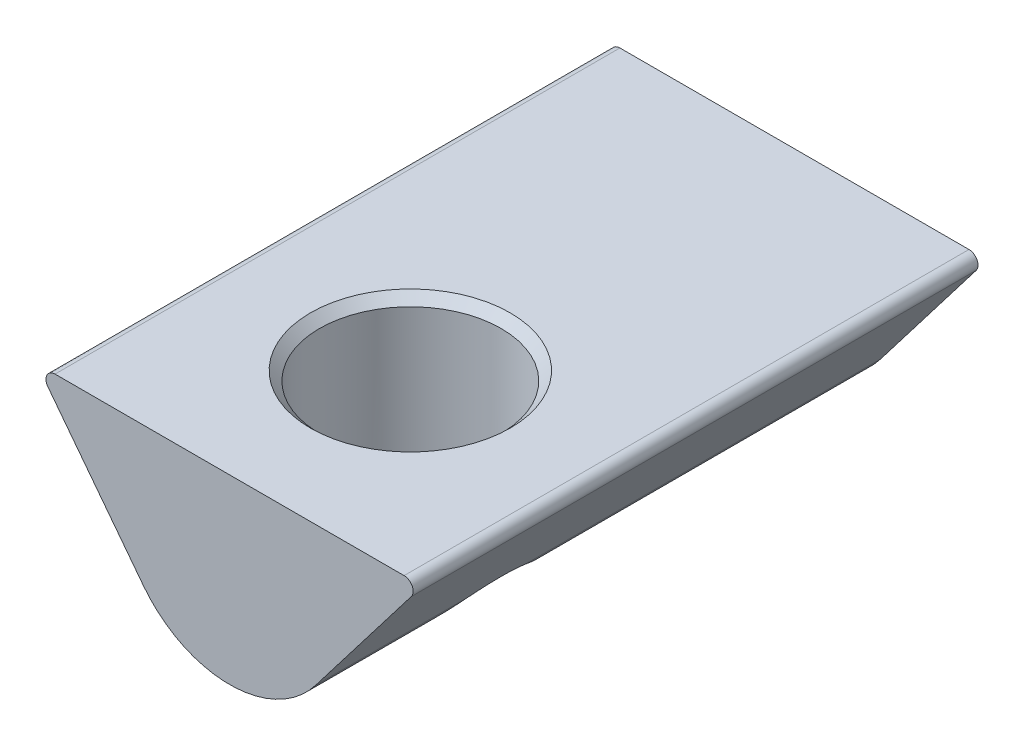
from build123d import *

# Parameters (mm, degrees)
BOSS_EXTRUDE1_DEPTH         = 15.875
TAP_DRILL_FOR_1_4_20_TAP1_D = 5.1054
CHAMFER1_SIZE               = 0.254


with BuildPart() as part:
    # Model → Boss-Extrude1 (new body)
    with BuildSketch(Plane.XY):
        with BuildLine():
            Line((15.773627649, 23.305847831), (25.584064841, 23.305847831))
            ThreePointArc((25.584064841, 23.305847831), (25.812010792, 23.16410193), (25.785700673, 22.896970812))
            Line((25.785700673, 22.896970812), (23.09847623, 19.394911734))
            ThreePointArc((23.09847623, 19.394911734), (20.678846245, 18.201682274), (18.25921626, 19.394911734))
            Line((18.25921626, 19.394911734), (15.571991817, 22.896970812))
            ThreePointArc((15.571991817, 22.896970812), (15.545681698, 23.16410193), (15.773627649, 23.305847831))
        make_face()
    extrude(amount=BOSS_EXTRUDE1_DEPTH)

    # Tap Drill for 1/4-20 Tap1 (through all)
    with Locations(Plane(origin=(0, 23.305847831, 0), x_dir=(1, 0, 0), z_dir=(0, 1, 0))):
        with Locations((20.678846245, -10.795)):
            Hole(TAP_DRILL_FOR_1_4_20_TAP1_D / 2)

    # Chamfer1
    chamfer1_edges = [part.edges().sort_by_distance(p)[0] for p in [
        (23.231546245, 23.305847831, 10.795),
    ]]
    chamfer(chamfer1_edges, length=CHAMFER1_SIZE)


solid = part.part
